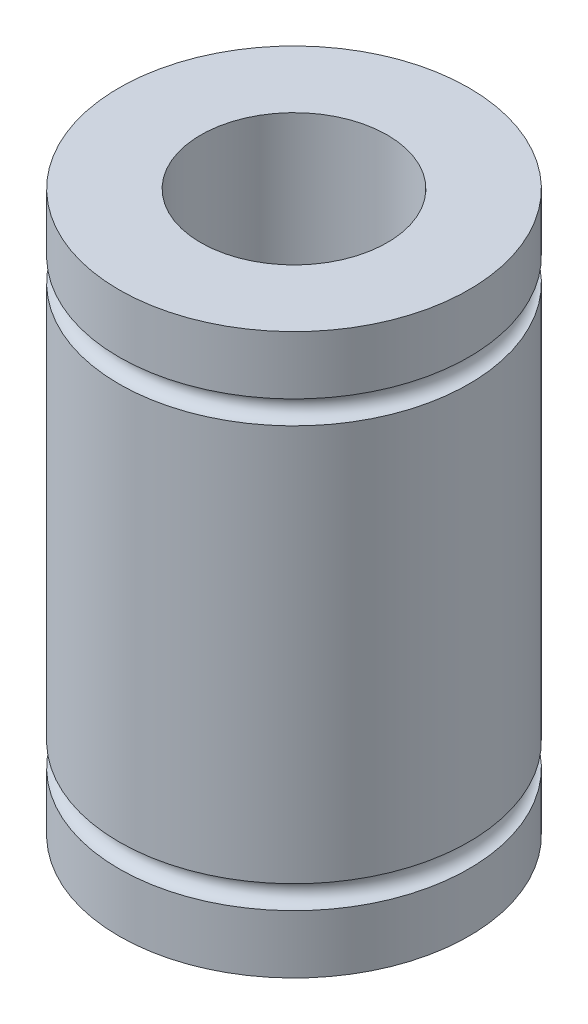
from build123d import *

# Parameters (mm, degrees)
SKETCH_1_R          = 7.5
EXTRUDE_1_DEPTH     = 24
SKETCH_2_R          = 4
CUT_EXTRUDE_1_DEPTH = 27.239283527
SKETCH_5_R          = 0.5
SKETCH_9_R          = 0.5


with BuildPart() as part:
    # 草图1 → 凸台-拉伸1 (new body)
    with BuildSketch(Plane(origin=(0, 0, 0), x_dir=(1, 0, 0), z_dir=(0, 1, 0))):
        Circle(SKETCH_1_R)
    extrude(amount=EXTRUDE_1_DEPTH)

    # 草图2 → 切除-拉伸1 (cut, through all)
    with BuildSketch(Plane.XZ):
        Circle(SKETCH_2_R)
    extrude(amount=-CUT_EXTRUDE_1_DEPTH, mode=Mode.SUBTRACT)

    # 切除-扫描1: sweep along a path in 草图3
    with BuildLine(Plane(origin=(0, 3, 0), x_dir=(-1, 0, 0), z_dir=(0, -1, 0))) as sweep_1_path:
        CenterArc((0, 0), 7.5, 0, 360)
    # 草图5 → 切除-扫描1 (sweep, cut)
    with BuildSketch(Plane(origin=(0, 0, 0), x_dir=(0, 0, -1), z_dir=(-1, 0, 0))):
        with Locations((7.5, -3)):
            Circle(SKETCH_5_R)
    sweep(path=sweep_1_path.line, mode=Mode.SUBTRACT)

    # 切除-扫描2: sweep along a path in 草图8
    with BuildLine(Plane(origin=(0, 21, 0), x_dir=(1, 0, 0), z_dir=(0, 1, 0))) as sweep_2_path:
        CenterArc((0, 0), 7.5, 0, 360)
    # 草图9 → 切除-扫描2 (sweep, cut)
    with BuildSketch(Plane.XY):
        with Locations((-7.5, 21)):
            Circle(SKETCH_9_R)
    sweep(path=sweep_2_path.line, mode=Mode.SUBTRACT)


solid = part.part
